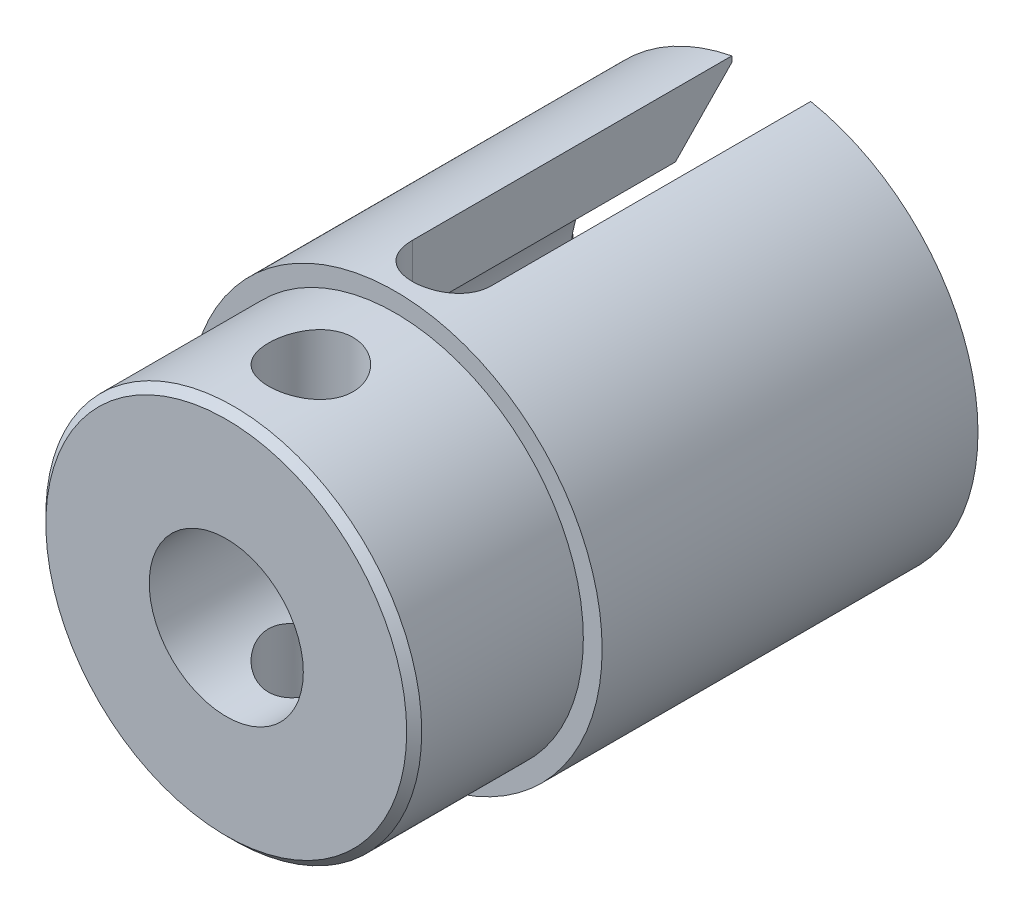
from build123d import *

# Parameters (mm, degrees)
SKETCH_1_R           = 11
EXTRUDE_1_DEPTH      = 29
SKETCH_2_OUTSIDE_W   = 32.506
SKETCH_2_OUTSIDE_H   = 32.506
SKETCH_2_OUTSIDE_R   = 10
CUT_EXTRUDE_1_DEPTH  = 9
SKETCH_3_R           = 7.7
CUT_EXTRUDE_2_DEPTH  = 20
SKETCH_4_R           = 2.1
CUT_EXTRUDE_3_DEPTH  = 25
CHAMFER_1_SIZE       = 3
EXTRUDE_START        = 10
SKETCH_5_R           = 10
EXTRUDE_2_DEPTH      = 10
CUT_EXTRUDE_5_DEPTH  = 19
CUT_EXTRUDE_6_DEPTH  = 19
CHAMFER_2_SIZE       = 0.4
SKETCH_12_R          = 10
CUT_EXTRUDE_9_DEPTH  = 10
SKETCH_13_R          = 4.1
CUT_EXTRUDE_10_DEPTH = 9
SKETCH_14_R          = 2.25
CUT_EXTRUDE_11_DEPTH = 25
CHAMFER_3_SIZE       = 0.4


with BuildPart() as part:
    # 草图1 → 凸台-拉伸1 (new body)
    with BuildSketch(Plane.XY):
        with Locations(Location((0, 0, 0), (0, 0, 180))):
            Circle(SKETCH_1_R)
    extrude(amount=EXTRUDE_1_DEPTH)

    # 草图2 outside → 切除-拉伸1 (cut)
    with BuildSketch(Plane.XY.offset(29)):
        Rectangle(SKETCH_2_OUTSIDE_W, SKETCH_2_OUTSIDE_H)
        Circle(SKETCH_2_OUTSIDE_R, mode=Mode.SUBTRACT)
    extrude(amount=-CUT_EXTRUDE_1_DEPTH, mode=Mode.SUBTRACT)

    # 草图3 → 切除-拉伸2 (cut)
    with BuildSketch(Plane(origin=(0, 0, 0), x_dir=(-1, 0, 0), z_dir=(0, 0, -1))):
        Circle(SKETCH_3_R)
    extrude(amount=-CUT_EXTRUDE_2_DEPTH, mode=Mode.SUBTRACT)

    # 草图4 → 切除-拉伸3 (cut, symmetric)
    with BuildSketch(Plane(origin=(0, 0, 0), x_dir=(1, 0, 0), z_dir=(0, 1, 0))):
        with BuildLine():
            Line((-2.1, 0), (-2.1, -17))
            ThreePointArc((-2.1, -17), (0, -14.9), (2.1, -17))
            Line((2.1, -17), (2.1, 0))
            Line((2.1, 0), (-2.1, 0))
        make_face()
        with Locations((0, -17)):
            Circle(SKETCH_4_R)
    extrude(amount=CUT_EXTRUDE_3_DEPTH, both=True, mode=Mode.SUBTRACT)

    # 倒角1
    chamfer_1_edges = [part.edges().sort_by_distance(p)[0] for p in [
        (7.7, 0, 0),
        (-6.142475071, -4.643274706, 0),
    ]]
    chamfer(chamfer_1_edges, length=CHAMFER_1_SIZE)

    # 草图5 → 凸台-拉伸2 (add)
    with BuildSketch(Plane.XY.offset(29).offset(EXTRUDE_START)):
        Circle(SKETCH_5_R)
    extrude(amount=-EXTRUDE_2_DEPTH)

    # 草图6 → 切除-拉伸5 (cut)
    with BuildSketch(Plane.XY.offset(39)):
        with BuildLine():
            Line((3.122498999, 2.5), (-3.122498999, 2.5))
            ThreePointArc((-3.122498999, 2.5), (-1.324764885, -3.774254628), (4, 0))
            ThreePointArc((4, 0), (3.774254628, 1.324764885), (3.122498999, 2.5))
        make_face()
    extrude(amount=-CUT_EXTRUDE_5_DEPTH, mode=Mode.SUBTRACT)

    # 草图7 → 切除-拉伸6 (cut)
    with BuildSketch(Plane.XY.offset(39)):
        with BuildLine():
            Line((3.170173497, 2.6), (-3.170173497, 2.6))
            ThreePointArc((-3.170173497, 2.6), (0, -4.1), (3.170173497, 2.6))
        make_face()
    extrude(amount=-CUT_EXTRUDE_6_DEPTH, mode=Mode.SUBTRACT)

    # 倒角2
    chamfer_2_edges = [part.edges().sort_by_distance(p)[0] for p in [
        (0, -4.1, 39),
        (0, 2.6, 39),
    ]]
    chamfer(chamfer_2_edges, length=CHAMFER_2_SIZE)

    # 草图12 → 切除-拉伸9 (cut)
    with BuildSketch(Plane.XY.offset(39)):
        Circle(SKETCH_12_R)
    extrude(amount=-CUT_EXTRUDE_9_DEPTH, mode=Mode.SUBTRACT)

    # 草图13 → 切除-拉伸10 (cut)
    with BuildSketch(Plane.XY.offset(29)):
        Circle(SKETCH_13_R)
    extrude(amount=-CUT_EXTRUDE_10_DEPTH, mode=Mode.SUBTRACT)

    # 草图14 → 切除-拉伸11 (cut, symmetric)
    with BuildSketch(Plane(origin=(0, 0, 0), x_dir=(1, 0, 0), z_dir=(0, 1, 0))):
        with Locations(Location((0, -24.5, 0), (0, 0, 270))):
            Circle(SKETCH_14_R)
    extrude(amount=CUT_EXTRUDE_11_DEPTH, both=True, mode=Mode.SUBTRACT)

    # 倒角3
    chamfer_3_edges = [part.edges().sort_by_distance(p)[0] for p in [
        (-10, 0, 29),
    ]]
    chamfer(chamfer_3_edges, length=CHAMFER_3_SIZE)


solid = part.part
